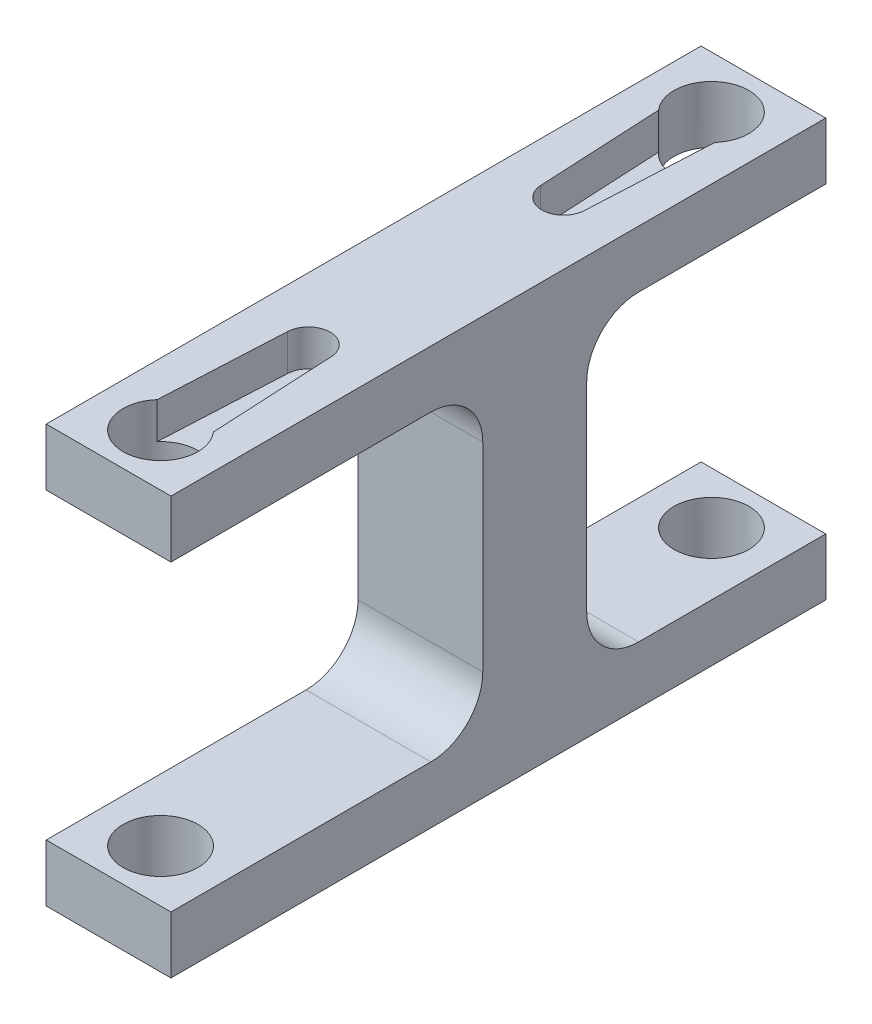
from build123d import *

# Parameters (mm, degrees)
SKETCH2_W            = 12
SKETCH2_H            = 40.15
BOSS_EXTRUDE2_DEPTH  = 2.5
SKETCH11_W           = 12
SKETCH11_H           = 5.5
BOSS_EXTRUDE8_DEPTH  = 30
CUT_EXTRUDE1_DEPTH   = 3.5
SKETCH14_W           = 12
SKETCH14_H           = 40.15
BOSS_EXTRUDE9_DEPTH  = 7.5
SKETCH16_W           = 12
SKETCH16_H           = 5.5
BOSS_EXTRUDE11_DEPTH = 23
CUT_EXTRUDE4_DEPTH   = 3.5
SKETCH22_R           = 3.6
CUT_EXTRUDE6_DEPTH   = 53.368236301
SKETCH23_R           = 3.6
CUT_EXTRUDE7_DEPTH   = 53.368236301
FILLET1_R            = 5
FILLET2_R            = 5
FILLET3_R            = 5
FILLET4_R            = 5


with BuildPart() as part:
    # Sketch2 → Boss-Extrude2 (new body)
    with BuildSketch(Plane.XY):
        with Locations((-2.61160109, -19.108451256)):
            Rectangle(SKETCH2_W, SKETCH2_H)
    extrude(amount=BOSS_EXTRUDE2_DEPTH)

    # Sketch11 → Boss-Extrude8 (add)
    with BuildSketch(Plane.XY.offset(2.5)):
        with Locations((-2.61160109, -1.783451256)):
            Rectangle(SKETCH11_W, SKETCH11_H)
        with Locations((-2.61160109, -36.433451256)):
            Rectangle(SKETCH11_W, SKETCH11_H)
    extrude(amount=BOSS_EXTRUDE8_DEPTH)

    # Sketch12 → Cut-Extrude1 (cut)
    with BuildSketch(Plane(origin=(0, 0.966548744, 0), x_dir=(1, 0, 0), z_dir=(0, 1, 0))):
        with BuildLine():
            Line((-0.514266567, -13.168774056), (0.08839891, -25.11882382))
            ThreePointArc((0.08839891, -25.11882382), (-2.61160109, -31.1), (-5.31160109, -25.11882382))
            Line((-5.31160109, -25.11882382), (-4.708935612, -13.168774056))
            ThreePointArc((-4.708935612, -13.168774056), (-2.61160109, -11.174546931), (-0.514266567, -13.168774056))
        make_face()
    extrude(amount=-CUT_EXTRUDE1_DEPTH, mode=Mode.SUBTRACT)

    # Sketch14 → Boss-Extrude9 (add)
    with BuildSketch(Plane(origin=(0, 0, 0), x_dir=(-1, 0, 0), z_dir=(0, 0, -1))):
        with Locations((2.61160109, -19.108451256)):
            Rectangle(SKETCH14_W, SKETCH14_H)
    extrude(amount=BOSS_EXTRUDE9_DEPTH)

    # Sketch16 → Boss-Extrude11 (add)
    with BuildSketch(Plane(origin=(0, 0, -7.5), x_dir=(-1, 0, 0), z_dir=(0, 0, -1))):
        with Locations((2.61160109, -1.783451256)):
            Rectangle(SKETCH16_W, SKETCH16_H)
        with Locations((2.61160109, -36.433451256)):
            Rectangle(SKETCH16_W, SKETCH16_H)
    extrude(amount=BOSS_EXTRUDE11_DEPTH)

    # Sketch20 → Cut-Extrude4 (cut)
    with BuildSketch(Plane(origin=(0, 0.966548744, 0), x_dir=(1, 0, 0), z_dir=(0, 1, 0))):
        with BuildLine():
            Line((-4.708935612, 11.168774056), (-5.31160109, 23.11882382))
            ThreePointArc((-5.31160109, 23.11882382), (-2.61160109, 29.1), (0.08839891, 23.11882382))
            Line((0.08839891, 23.11882382), (-0.514266567, 11.168774056))
            ThreePointArc((-0.514266567, 11.168774056), (-2.61160109, 9.174546931), (-4.708935612, 11.168774056))
        make_face()
    extrude(amount=-CUT_EXTRUDE4_DEPTH, mode=Mode.SUBTRACT)

    # Sketch22 → Cut-Extrude6 (cut, through all)
    with BuildSketch(Plane(origin=(0, 0.966548744, 0), x_dir=(1, 0, 0), z_dir=(0, 1, 0))):
        with Locations(Location((-2.61160109, -27.5, 0), (0, 0, 270))):
            Circle(SKETCH22_R)
    extrude(amount=-CUT_EXTRUDE6_DEPTH, mode=Mode.SUBTRACT)

    # Sketch23 → Cut-Extrude7 (cut, through all)
    with BuildSketch(Plane(origin=(0, 0.966548744, 0), x_dir=(1, 0, 0), z_dir=(0, 1, 0))):
        with Locations(Location((-2.61160109, 25.5, 0), (0, 0, 221.409622109))):
            Circle(SKETCH23_R)
    extrude(amount=-CUT_EXTRUDE7_DEPTH, mode=Mode.SUBTRACT)

    # Fillet1
    fillet1_edges = [part.edges().sort_by_distance(p)[0] for p in [
        (-2.61160109, -4.533451256, 2.5),
    ]]
    fillet(fillet1_edges, radius=FILLET1_R)

    # Fillet2
    fillet2_edges = [part.edges().sort_by_distance(p)[0] for p in [
        (-2.61160109, -33.683451256, 2.5),
    ]]
    fillet(fillet2_edges, radius=FILLET2_R)

    # Fillet3
    fillet3_edges = [part.edges().sort_by_distance(p)[0] for p in [
        (-2.61160109, -4.533451256, -7.5),
    ]]
    fillet(fillet3_edges, radius=FILLET3_R)

    # Fillet4
    fillet4_edges = [part.edges().sort_by_distance(p)[0] for p in [
        (-2.61160109, -33.683451256, -7.5),
    ]]
    fillet(fillet4_edges, radius=FILLET4_R)


solid = part.part
